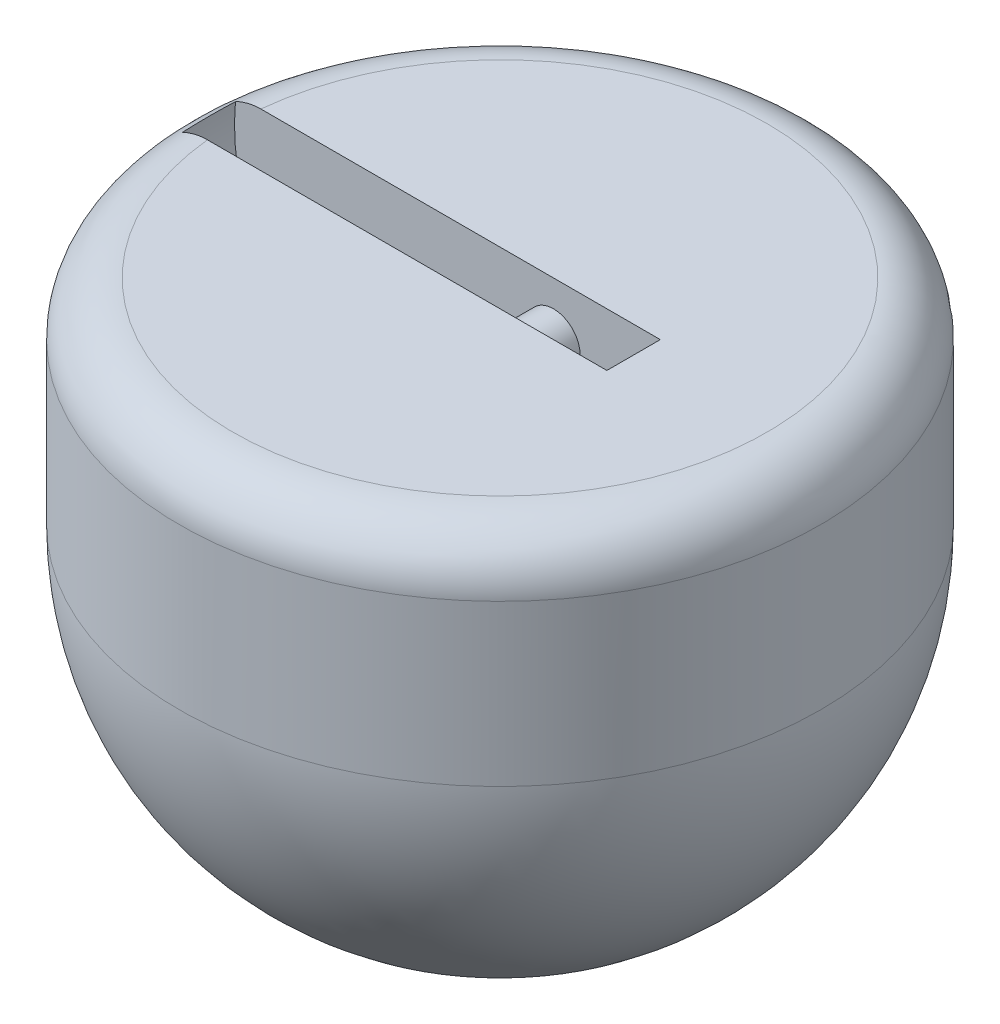
from build123d import *

# Parameters (mm, degrees)
CUT_EXTRUDE_1_DEPTH = 1
SKETCH_3_R          = 1
EXTRUDE_1_DEPTH     = 1


with BuildPart() as part:
    # 草图1 → 旋转1 (revolve)
    with BuildSketch(Plane.XY, mode=Mode.PRIVATE) as revolve_1_sk:
        with BuildLine():
            Line((0, 0), (10, 0))
            ThreePointArc((10, 0), (11.414213562, -0.585786438), (12, -2))
            Line((12, -2), (12, -8))
            ThreePointArc((12, -8), (8.485281374, -16.485281374), (0, -20))
            Line((0, -20), (0, 0))
        make_face()
    revolve(revolve_1_sk.sketch.rotate(Axis((0, -20, 0), (0, 1, 0)), 90), axis=Axis((0, -20, 0), (0, 1, 0)))

    # 草图2 → 切除-拉伸1 (cut, symmetric)
    with BuildSketch(Plane.XY):
        with BuildLine():
            Line((5, 0), (-10.874507866, 0))
            ThreePointArc((-10.874507866, 0), (-2.937253933, -9), (5, 0))
        make_face()
    extrude(amount=CUT_EXTRUDE_1_DEPTH, both=True, mode=Mode.SUBTRACT)

    # 草图3 → 凸台-拉伸1 (add, symmetric)
    with BuildSketch(Plane.XY):
        with Locations(Location((1, -2, 0), (0, 0, 180))):
            Circle(SKETCH_3_R)
        with Locations(Location((-3, -5, 0), (0, 0, 180))):
            Circle(SKETCH_3_R)
    extrude(amount=EXTRUDE_1_DEPTH, both=True)


solid = part.part
